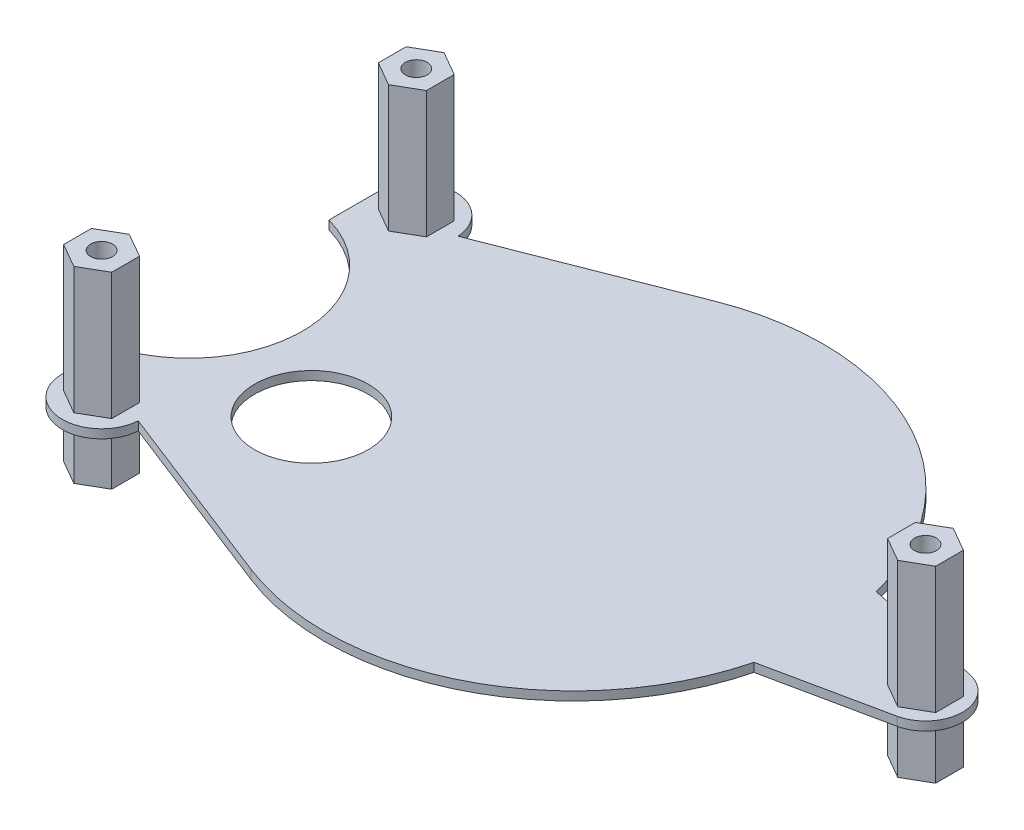
from build123d import *

# Parameters (mm, degrees)
SKETCH1_R                  = 6.5
BOSS_EXTRUDE1_DEPTH        = 1
BOSS_EXTRUDE2_DEPTH        = 14.5
BOSS_EXTRUDE2_DEPTH_BACK   = 7
M3_TAPPED_HOLE1_AT_2_COUNT = 2
M3_TAPPED_HOLE1_AT_2_PITCH = 78.345788017
M3_TAPPED_HOLE1_AT_3_COUNT = 2
M3_TAPPED_HOLE1_AT_3_PITCH = 36


with BuildPart() as part:
    # Sketch1 → Boss-Extrude1 (new body)
    with BuildSketch(Plane(origin=(0, 0, 0), x_dir=(1, 0, 0), z_dir=(0, 1, 0))):
        with BuildLine():
            Line((11.636363636, 26.548917894), (-9.50963812, 18.294364031))
            ThreePointArc((-9.50963812, 18.294364031), (-14.147260888, 22.497589825), (-18.5, 18))
            Line((-18.5, 18), (-18.5, 12.519984026))
            ThreePointArc((-18.5, 12.519984026), (-9, 0), (-18.5, -12.519984026))
            Line((-18.5, -12.519984026), (-18.5, -18))
            ThreePointArc((-18.5, -18), (-14.147260888, -22.497589825), (-9.50963812, -18.294364031))
            Line((-9.50963812, -18.294364031), (11.636363636, -26.548917894))
            ThreePointArc((11.636363636, -26.548917894), (35.040161132, -25.341748118), (49.626979567, -7))
            Line((49.626979567, -7), (63.125355805, -4.158876316))
            ThreePointArc((63.125355805, -4.158876316), (66.5, 0), (63.125355805, 4.158876316))
            Line((63.125355805, 4.158876316), (49.626979567, 7))
            ThreePointArc((49.626979567, 7), (35.040161132, 25.341748118), (11.636363636, 26.548917894))
        make_face()
        with Locations(Location((0, -8, 0), (0, 0, 270))):
            Circle(SKETCH1_R, mode=Mode.SUBTRACT)
    extrude(amount=BOSS_EXTRUDE1_DEPTH)

    # Sketch2 → Boss-Extrude2 (add, two sides: drawn at the far end of the back side and taken through both)
    with BuildSketch(Plane(origin=(0, 1, 0), x_dir=(1, 0, 0), z_dir=(0, 1, 0)).offset(-BOSS_EXTRUDE2_DEPTH_BACK)):
        Polygon((-11.25, 16.41228676), (-11.25, 19.58771324), (-14, 21.175426481), (-16.75, 19.58771324), (-16.75, 16.41228676), (-14, 14.824573519), align=None)
        Polygon((-14, -14.824573519), (-11.25, -16.41228676), (-11.25, -19.58771324), (-14, -21.175426481), (-16.75, -19.58771324), (-16.75, -16.41228676), align=None)
        Polygon((65, 1.58771324), (62.25, 3.175426481), (59.5, 1.58771324), (59.5, -1.58771324), (62.25, -3.175426481), (65, -1.58771324), align=None)
    extrude(amount=BOSS_EXTRUDE2_DEPTH + BOSS_EXTRUDE2_DEPTH_BACK)

    # Sketch4 → M3 Tapped Hole1 (revolve, cut)
    with BuildSketch(Plane(origin=(-14, 15.5, -18), x_dir=(0, 0, 1), z_dir=(1, 0, 0))):
        Polygon((0, 0), (0, 8.251075774), (1.25, 7.5), (1.25, 0), align=None)
    m3_tapped_hole1 = revolve(axis=Axis((-14, 21.85, -18), (0, -1, 0)), mode=Mode.SUBTRACT)

    # M3 Tapped Hole1 at 2: M3 Tapped Hole1 ×2
    with Locations(*[Vector(0.9732495125772933, 0, 0.22975070460841018) * (i * M3_TAPPED_HOLE1_AT_2_PITCH) for i in range(1, M3_TAPPED_HOLE1_AT_2_COUNT)]):
        add(m3_tapped_hole1, mode=Mode.SUBTRACT)

    # M3 Tapped Hole1 at 3: M3 Tapped Hole1 ×2
    with Locations(*[(0, 0, i * M3_TAPPED_HOLE1_AT_3_PITCH) for i in range(1, M3_TAPPED_HOLE1_AT_3_COUNT)]):
        add(m3_tapped_hole1, mode=Mode.SUBTRACT)

    # Mirror2: M3 Tapped Hole1 across plane
    add(m3_tapped_hole1.mirror(Plane.ZX.offset(4.75)), mode=Mode.SUBTRACT)

    # Mirror2 copy 1 sketch → Mirror2 copy 1 (revolve, cut)
    with BuildSketch(Plane(origin=(62.25, -6, 0), x_dir=(0, 0, 1), z_dir=(1, 0, 0))):
        Polygon((0, 0), (0, -8.251075774), (1.25, -7.5), (1.25, 0), align=None)
    revolve(axis=Axis((62.25, -12.35, 0), (0, -1, 0)), mode=Mode.SUBTRACT)

    # Mirror2 copy 2 sketch → Mirror2 copy 2 (revolve, cut)
    with BuildSketch(Plane(origin=(-14, -6, 18), x_dir=(0, 0, 1), z_dir=(1, 0, 0))):
        Polygon((0, 0), (0, -8.251075774), (1.25, -7.5), (1.25, 0), align=None)
    revolve(axis=Axis((-14, -12.35, 18), (0, -1, 0)), mode=Mode.SUBTRACT)


solid = part.part
